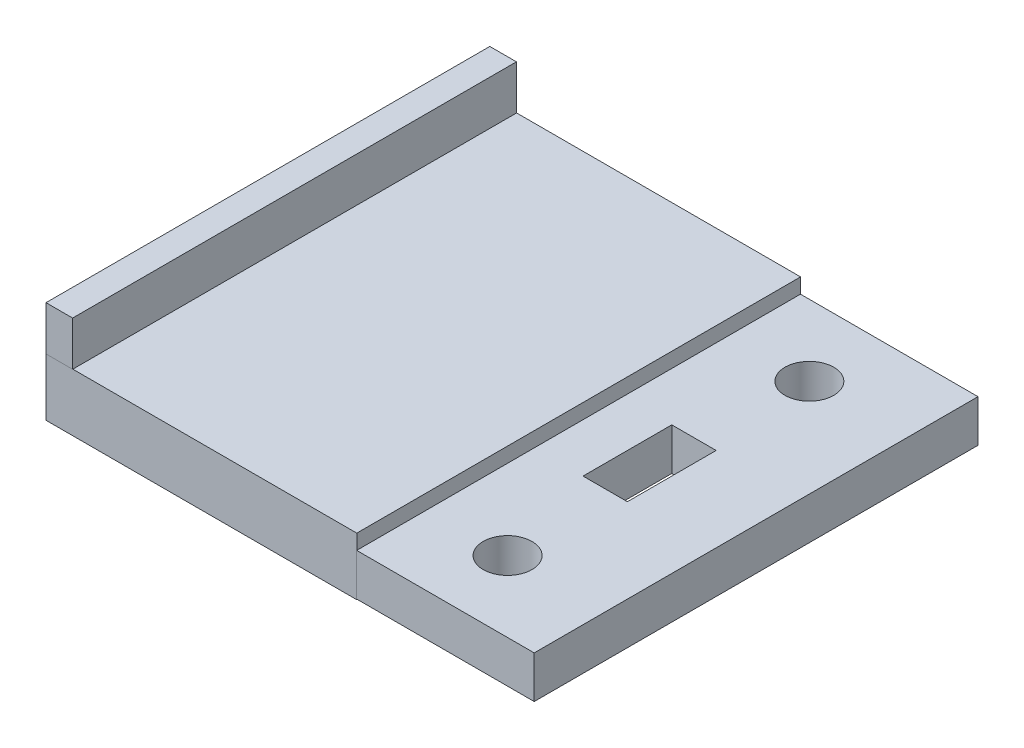
from build123d import *

# Parameters (mm, degrees)
ESQUISSE2_W             = 20
ESQUISSE2_H             = 50
BOSS_EXTRU_1_DEPTH      = 4.75
ESQUISSE3_R             = 2.75
ENL_V_MAT_EXTRU_1_DEPTH = 43.183776378
ESQUISSE6_W             = 50
ESQUISSE6_H             = 6.5
BOSS_EXTRU_2_DEPTH      = 35
ESQUISSE7_W             = 3
ESQUISSE7_H             = 50
BOSS_EXTRU_3_DEPTH      = 5
ESQUISSE8_W             = 5
ESQUISSE8_H             = 10
ENL_V_MAT_EXTRU_2_DEPTH = 5.5


with BuildPart() as part:
    # Esquisse2 → Boss.-Extru.1 (new body)
    with BuildSketch(Plane(origin=(0, 0, 0), x_dir=(1, 0, 0), z_dir=(0, 1, 0))):
        with Locations((-2.628205128, -14.967948718)):
            Rectangle(ESQUISSE2_W, ESQUISSE2_H)
    extrude(amount=BOSS_EXTRU_1_DEPTH)

    # Esquisse3 → Enlèv. mat.-Extru.1 (cut, through all)
    with BuildSketch(Plane(origin=(0, 4.75, 0), x_dir=(1, 0, 0), z_dir=(0, 1, 0))):
        with Locations(Location((-3.628205128, 2.032051282, 0), (0, 0, 270))):
            Circle(ESQUISSE3_R)
        with Locations(Location((-3.628205128, -31.967948718, 0), (0, 0, 270))):
            Circle(ESQUISSE3_R)
    extrude(amount=-ENL_V_MAT_EXTRU_1_DEPTH, mode=Mode.SUBTRACT)

    # Esquisse6 → Boss.-Extru.2 (add)
    with BuildSketch(Plane.ZY.offset(12.628205128)):
        with Locations((14.958265228, 3.181677952)):
            Rectangle(ESQUISSE6_W, ESQUISSE6_H)
    extrude(amount=BOSS_EXTRU_2_DEPTH)

    # Esquisse7 → Boss.-Extru.3 (add)
    with BuildSketch(Plane(origin=(0, 6.431677952, 0), x_dir=(1, 0, 0), z_dir=(0, 1, 0))):
        with Locations((-46.119685934, -14.980159327)):
            Rectangle(ESQUISSE7_W, ESQUISSE7_H)
    extrude(amount=BOSS_EXTRU_3_DEPTH)

    # Esquisse8 → Enlèv. mat.-Extru.2 (cut)
    with BuildSketch(Plane(origin=(0, 4.75, 0), x_dir=(1, 0, 0), z_dir=(0, 1, 0))):
        with Locations((-4.628205128, -14.967948718)):
            Rectangle(ESQUISSE8_W, ESQUISSE8_H)
    extrude(amount=-ENL_V_MAT_EXTRU_2_DEPTH, mode=Mode.SUBTRACT)


solid = part.part
